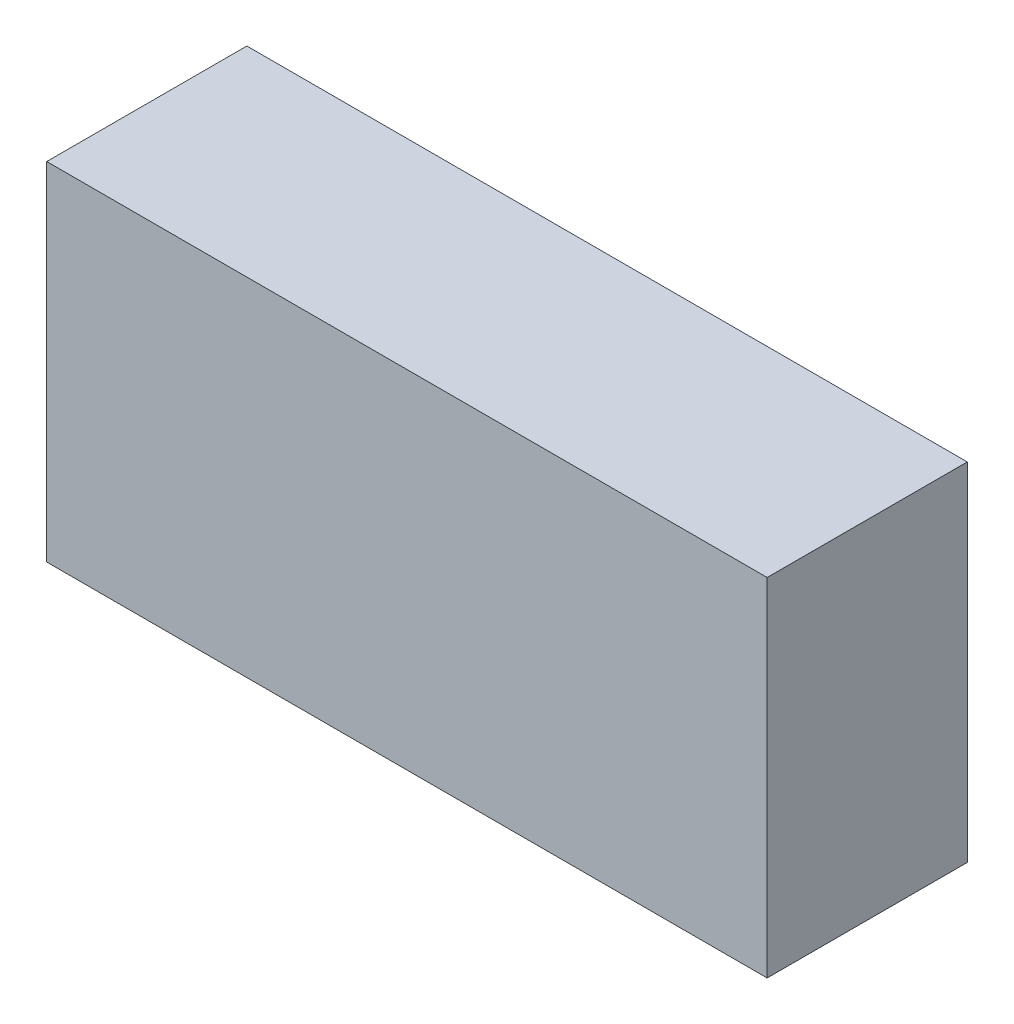
from build123d import *

# Parameters (mm, degrees)
CONTROLLER_AND_CONNECTOR_ENVELOPE_PROFIL_W = 54
CONTROLLER_AND_CONNECTOR_ENVELOPE_PROFIL_H = 26
CONTROLLER_AND_CONNECTOR_ENVELOPE_DEPTH    = 15


with BuildPart() as part:
    # Controller and connector envelope profile → Controller and connector envelope (new body)
    with BuildSketch(Plane.XY):
        Rectangle(CONTROLLER_AND_CONNECTOR_ENVELOPE_PROFIL_W, CONTROLLER_AND_CONNECTOR_ENVELOPE_PROFIL_H)
    extrude(amount=CONTROLLER_AND_CONNECTOR_ENVELOPE_DEPTH)


solid = part.part
